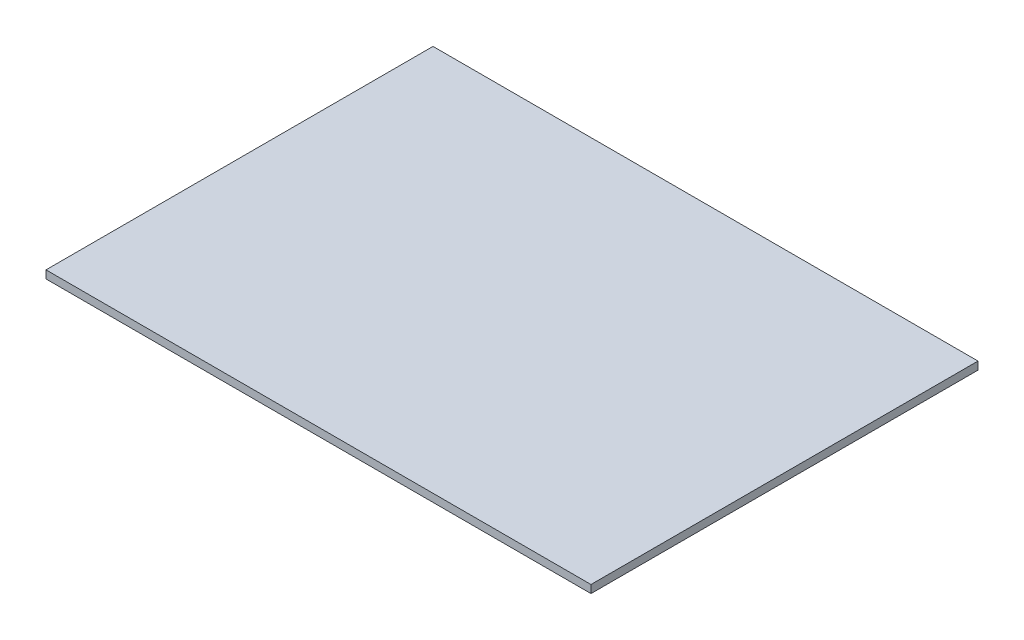
from build123d import *

# Parameters (mm, degrees)
SKETCH1_W           = 876.3
SKETCH1_H           = 622.3
BOSS_EXTRUDE1_DEPTH = 12.7


with BuildPart() as part:
    # Sketch1 → Boss-Extrude1 (new body)
    with BuildSketch(Plane(origin=(0, 0, 0), x_dir=(1, 0, 0), z_dir=(0, 1, 0))):
        with Locations((438.15, 311.15)):
            Rectangle(SKETCH1_W, SKETCH1_H)
    extrude(amount=BOSS_EXTRUDE1_DEPTH)


solid = part.part
